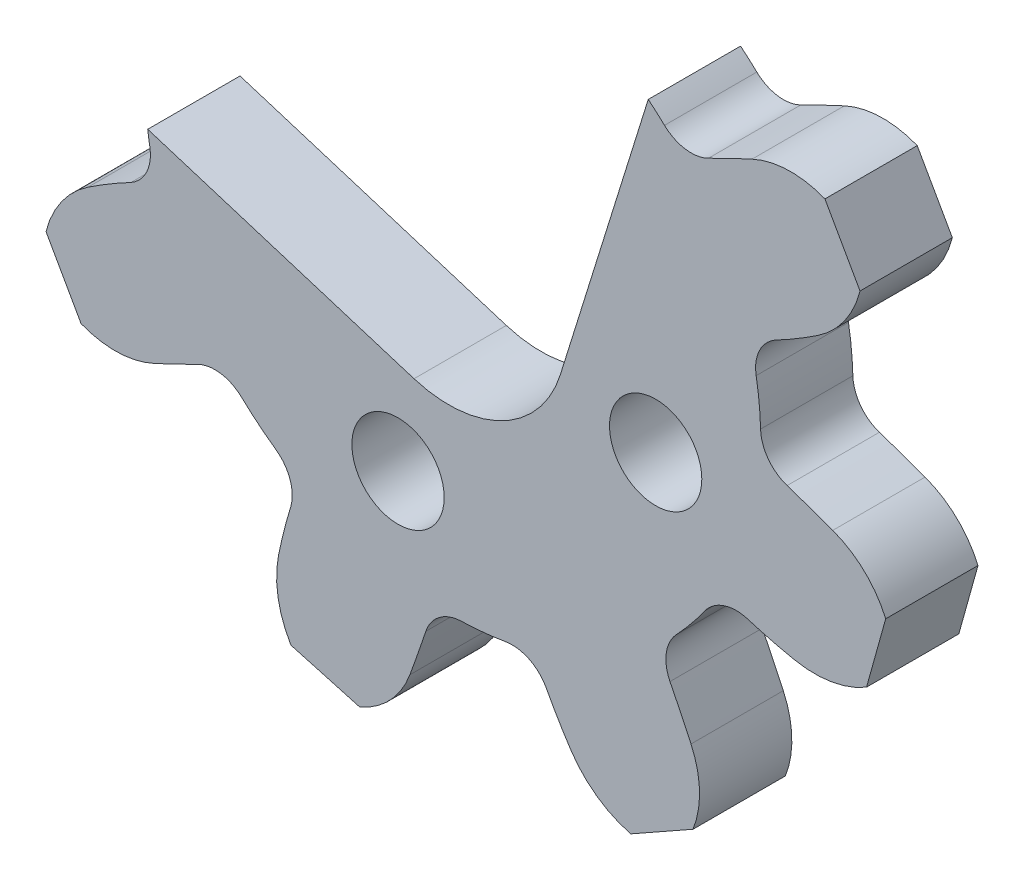
from build123d import *

# Parameters (mm, degrees)
SKETCH2_R           = 1.5
BOSS_EXTRUDE1_DEPTH = 3


with BuildPart() as part:
    # Sketch2 → Boss-Extrude1 (new body)
    with BuildSketch(Plane.XY):
        with BuildLine():
            Line((-5.130837683, -13.128424026), (-2.894599476, -13.751610881))
            ThreePointArc((-2.894599476, -13.751610881), (-1.902869034, -13.059138353), (-1.265820479, -12.030927961))
            ThreePointArc((-1.265820479, -12.030927961), (-1.000827399, -11.290628355), (-0.747207621, -10.546355659))
            ThreePointArc((-0.747207621, -10.546355659), (-0.30318707, -9.93272623), (0.412593324, -9.685029331))
            ThreePointArc((0.412593324, -9.685029331), (1.131659239, -9.639264495), (1.845563328, -9.541841892))
            ThreePointArc((1.845563328, -9.541841892), (2.596203435, -9.643008857), (3.15286452, -10.156646632))
            ThreePointArc((3.15286452, -10.156646632), (3.547782962, -10.861950174), (3.978067939, -11.546251643))
            ThreePointArc((3.978067939, -11.546251643), (4.819108126, -12.412112682), (5.915423233, -12.917243477))
            Line((5.915423233, -12.917243477), (7.937342084, -11.776643927))
            ThreePointArc((7.937342084, -11.776643927), (8.148949384, -10.585732586), (7.872356196, -9.408216692))
            ThreePointArc((7.872356196, -9.408216692), (7.536263729, -8.697367417), (7.189319723, -7.991750882))
            ThreePointArc((7.189319723, -7.991750882), (7.069388136, -7.243879409), (7.40037315, -6.562598082))
            ThreePointArc((7.40037315, -6.562598082), (7.876468909, -6.021781071), (8.312387147, -5.448086465))
            ThreePointArc((8.312387147, -5.448086465), (8.914705705, -4.988839602), (9.671521286, -4.958417528))
            ThreePointArc((9.671521286, -4.958417528), (10.449495711, -5.177892937), (11.237627346, -5.357509721))
            ThreePointArc((11.237627346, -5.357509721), (12.444588777, -5.375060714), (13.576982034, -4.957030278))
            Line((13.576982034, -4.957030278), (14.200168888, -2.720792071))
            ThreePointArc((14.200168888, -2.720792071), (13.50769636, -1.729061629), (12.479485969, -1.092013074))
            ThreePointArc((12.479485969, -1.092013074), (11.739186363, -0.827019994), (10.994913667, -0.573400216))
            ThreePointArc((10.994913667, -0.573400216), (10.381284237, -0.129379665), (10.133587339, 0.586400729))
            ThreePointArc((10.133587339, 0.586400729), (10.087822503, 1.305466644), (9.990399899, 2.019370733))
            ThreePointArc((9.990399899, 2.019370733), (10.091566865, 2.77001084), (10.60520464, 3.326671925))
            ThreePointArc((10.60520464, 3.326671925), (11.310508182, 3.721590366), (11.994809651, 4.151875344))
            ThreePointArc((11.994809651, 4.151875344), (12.86067069, 4.992915531), (13.365801484, 6.089230637))
            Line((13.365801484, 6.089230637), (12.225201935, 8.111149489))
            ThreePointArc((12.225201935, 8.111149489), (11.034290594, 8.322756789), (9.8567747, 8.046163601))
            ThreePointArc((9.8567747, 8.046163601), (9.145925425, 7.710071134), (8.44030889, 7.363127128))
            ThreePointArc((8.44030889, 7.363127128), (7.692437416, 7.243195541), (7.011156089, 7.574180555))
            ThreePointArc((7.011156089, 7.574180555), (6.751023766, 7.811826282), (6.482680974, 8.040160387))
            Line((6.482680974, 8.040160387), (3.628271269, -1.129445746))
            ThreePointArc((3.628271269, -1.129445746), (1.766936473, -3.364213957), (-1.129445741, -3.628271253))
            Line((-1.129445741, -3.628271253), (-9.784805185, -0.93394157))
            ThreePointArc((-9.784805185, -0.93394157), (-9.752937689, -1.165878235), (-9.715649297, -1.39700532))
            ThreePointArc((-9.715649297, -1.39700532), (-9.816816262, -2.147645428), (-10.330454037, -2.704306512))
            ThreePointArc((-10.330454037, -2.704306512), (-11.035757579, -3.099224954), (-11.720059048, -3.529509932))
            ThreePointArc((-11.720059048, -3.529509932), (-12.585920087, -4.370550118), (-13.091050882, -5.466865225))
            Line((-13.091050882, -5.466865225), (-11.950451332, -7.488784076))
            ThreePointArc((-11.950451332, -7.488784076), (-10.759539991, -7.700391376), (-9.582024097, -7.423798189))
            ThreePointArc((-9.582024097, -7.423798189), (-8.871174822, -7.087705721), (-8.165558287, -6.740761716))
            ThreePointArc((-8.165558287, -6.740761716), (-7.417686814, -6.620830128), (-6.736405487, -6.951815142))
            ThreePointArc((-6.736405487, -6.951815142), (-6.195588476, -7.427910901), (-5.62189387, -7.863829139))
            ThreePointArc((-5.62189387, -7.863829139), (-5.162647007, -8.466147697), (-5.132224933, -9.222963278))
            ThreePointArc((-5.132224933, -9.222963278), (-5.351700342, -10.000937704), (-5.531317126, -10.789069338))
            ThreePointArc((-5.531317126, -10.789069338), (-5.548868119, -11.996030769), (-5.130837683, -13.128424026))
        make_face()
        with Locations((-1.650117588, -6.485647428)):
            Circle(SKETCH2_R, mode=Mode.SUBTRACT)
        with Locations((6.723705607, -1.776418232)):
            Circle(SKETCH2_R, mode=Mode.SUBTRACT)
    extrude(amount=BOSS_EXTRUDE1_DEPTH)


solid = part.part
